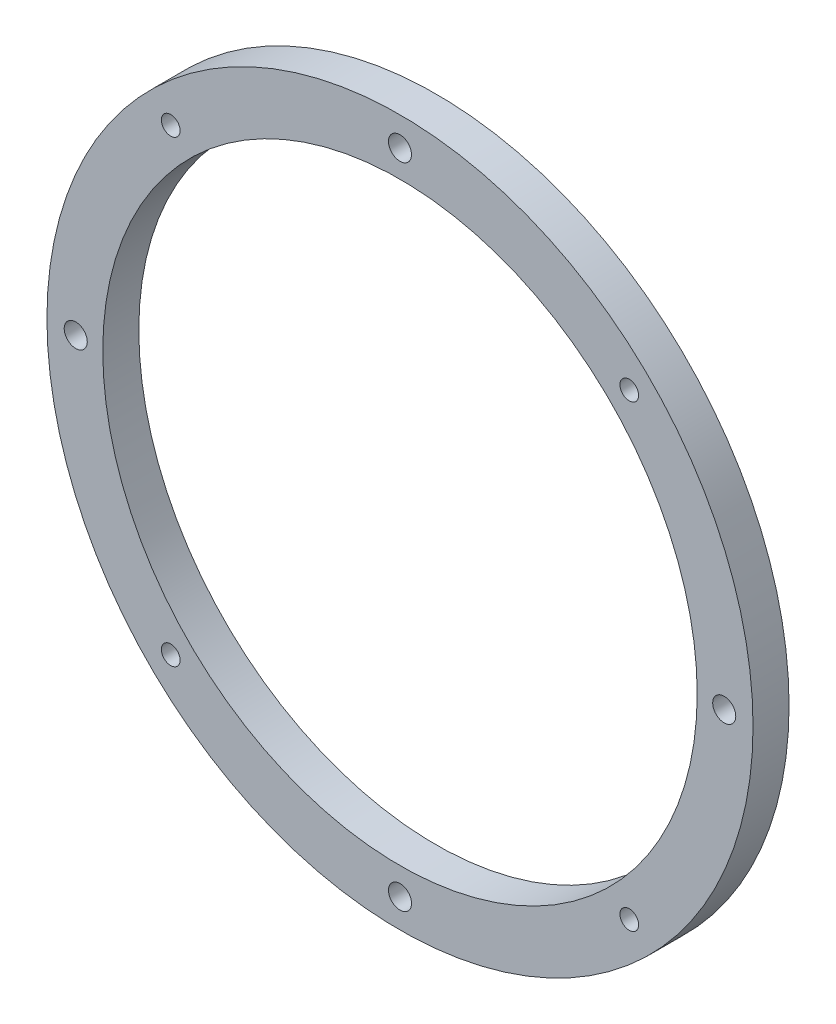
from build123d import *

# Parameters (mm, degrees)
SKETCH1_R           = 1244.6
SKETCH1_R_2         = 1047.78302
SKETCH1_R_3         = 40.64
SKETCH1_R_4         = 33.02
BOSS_EXTRUDE2_DEPTH = 127


with BuildPart() as part:
    # Sketch1 → Boss-Extrude2 (new body)
    with BuildSketch(Plane.XY):
        Circle(SKETCH1_R)
        Circle(SKETCH1_R_2, mode=Mode.SUBTRACT)
        with Locations((0, 1143)):
            Circle(SKETCH1_R_3, mode=Mode.SUBTRACT)
        with Locations((808.223050896, 808.223050896)):
            Circle(SKETCH1_R_4, mode=Mode.SUBTRACT)
        with Locations((1143, 0)):
            Circle(SKETCH1_R_3, mode=Mode.SUBTRACT)
        with Locations((808.223050896, -808.223050896)):
            Circle(SKETCH1_R_4, mode=Mode.SUBTRACT)
        with Locations((0, -1143)):
            Circle(SKETCH1_R_3, mode=Mode.SUBTRACT)
        with Locations((-808.223050896, -808.223050896)):
            Circle(SKETCH1_R_4, mode=Mode.SUBTRACT)
        with Locations((-1143, 0)):
            Circle(SKETCH1_R_3, mode=Mode.SUBTRACT)
        with Locations((-808.223050896, 808.223050896)):
            Circle(SKETCH1_R_4, mode=Mode.SUBTRACT)
    extrude(amount=BOSS_EXTRUDE2_DEPTH)


solid = part.part
